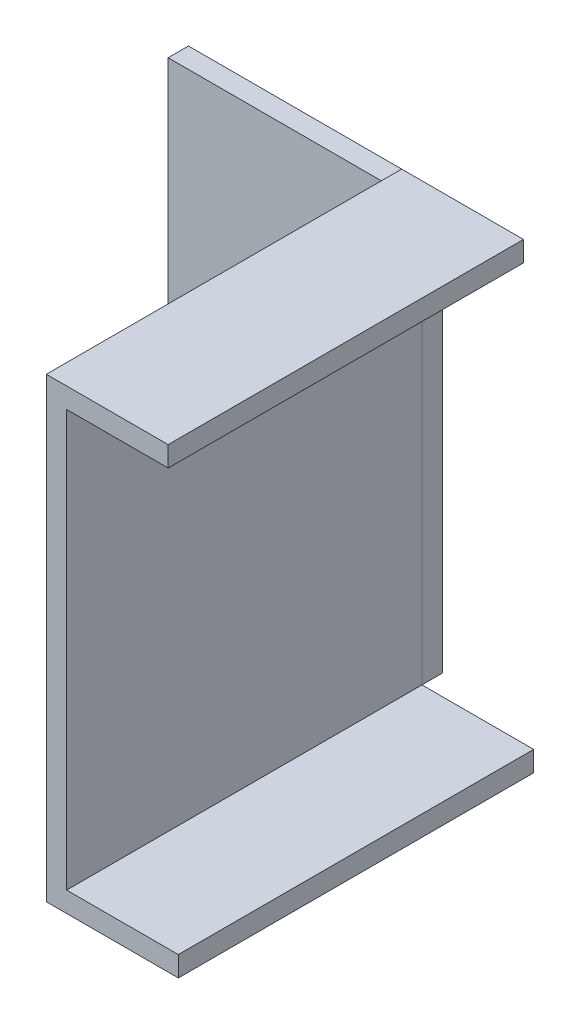
from build123d import *

# Parameters (mm, degrees)
BOSS_EXTRUDE1_DEPTH = 35
SKETCH2_W           = 25
SKETCH2_H           = 41
BOSS_EXTRUDE2_DEPTH = 2


with BuildPart() as part:
    # Sketch1 → Boss-Extrude1 (new body)
    with BuildSketch(Plane.XY):
        Polygon((0, 0), (0, 45), (12, 45), (12, 43), (2, 43), (2, 2), (13, 2), (13, 0), align=None)
    extrude(amount=BOSS_EXTRUDE1_DEPTH)


with BuildPart() as body_2:
    # Sketch2 → Boss-Extrude2 (new body)
    with BuildSketch(Plane(origin=(0, 0, 0), x_dir=(-1, 0, 0), z_dir=(0, 0, -1))):
        with Locations((10.5, 22.5)):
            Rectangle(SKETCH2_W, SKETCH2_H)
    extrude(amount=BOSS_EXTRUDE2_DEPTH)


solid = Compound([part.part, body_2.part])
